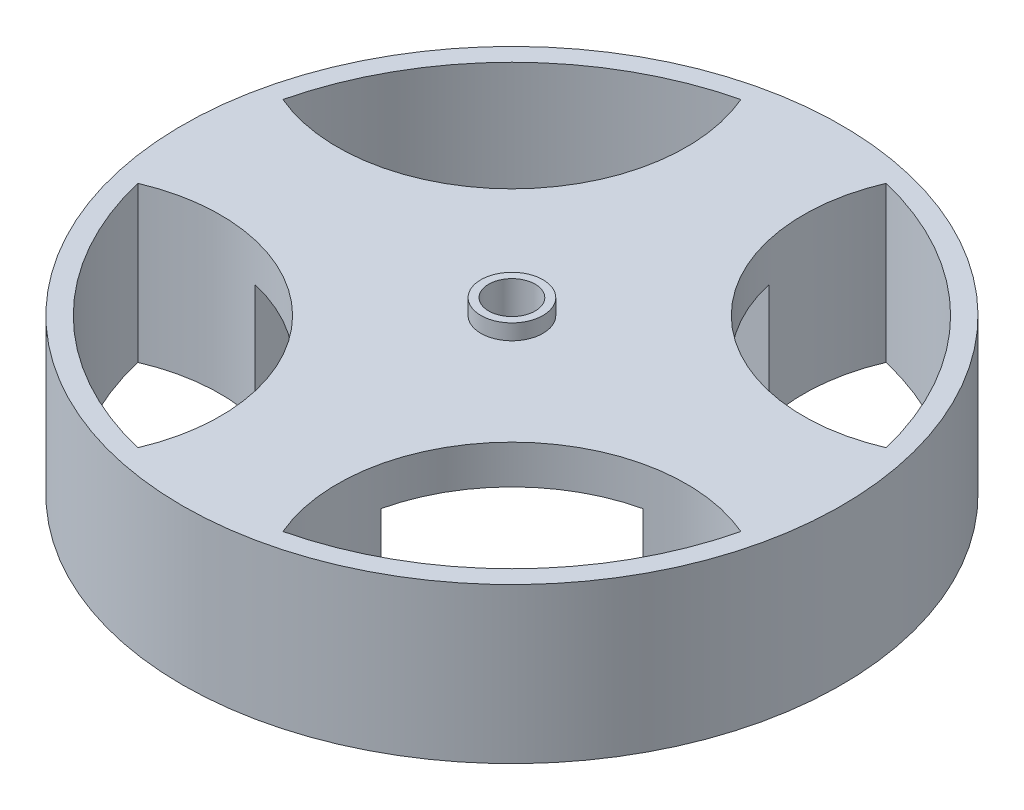
from build123d import *

# Parameters (mm, degrees)
SKETCH1_R           = 42.5
SKETCH1_R_2         = 40
BOSS_EXTRUDE1_DEPTH = 10
BOSS_EXTRUDE2_START = -5
BOSS_EXTRUDE2_DEPTH = 5
SKETCH3_R           = 4
SKETCH3_R_2         = 3
BOSS_EXTRUDE3_DEPTH = 2
SKETCH4_R           = 3
CUT_EXTRUDE1_DEPTH  = 64.344297297
BOSS_EXTRUDE4_START = 15
BOSS_EXTRUDE4_DEPTH = 15


with BuildPart() as part:
    # Sketch1 → Boss-Extrude1 (new, symmetric)
    with BuildSketch(Plane(origin=(0, 0, 0), x_dir=(1, 0, 0), z_dir=(0, 1, 0))):
        with Locations(Location((0, 0, 0), (0, 0, 270))):
            Circle(SKETCH1_R)
        with Locations(Location((0, 0, 0), (0, 0, 270))):
            Circle(SKETCH1_R_2, mode=Mode.SUBTRACT)
    extrude(amount=BOSS_EXTRUDE1_DEPTH, both=True)

    # Sketch2 → Boss-Extrude2 (add)
    with BuildSketch(Plane(origin=(0, 10, 0), x_dir=(1, 0, 0), z_dir=(0, 1, 0)).offset(BOSS_EXTRUDE2_START)):
        with BuildLine():
            ThreePointArc((-38.889408297, 9.36023089), (-14.142135624, 14.142135624), (-9.36023089, 38.889408297))
            ThreePointArc((-9.36023089, 38.889408297), (0, 40), (9.36023089, 38.889408297))
            ThreePointArc((9.36023089, 38.889408297), (14.142135624, 14.142135624), (38.889408297, 9.36023089))
            ThreePointArc((38.889408297, 9.36023089), (40, 0), (38.889408297, -9.36023089))
            ThreePointArc((38.889408297, -9.36023089), (14.142135624, -14.142135624), (9.36023089, -38.889408297))
            ThreePointArc((9.36023089, -38.889408297), (0, -40), (-9.36023089, -38.889408297))
            ThreePointArc((-9.36023089, -38.889408297), (-14.142135624, -14.142135624), (-38.889408297, -9.36023089))
            ThreePointArc((-38.889408297, -9.36023089), (-40, 0), (-38.889408297, 9.36023089))
        make_face()
    extrude(amount=BOSS_EXTRUDE2_DEPTH)

    # Sketch3 → Boss-Extrude3 (add)
    with BuildSketch(Plane(origin=(0, 10, 0), x_dir=(1, 0, 0), z_dir=(0, 1, 0))):
        with Locations(Location((0, 0, 0), (0, 0, 270))):
            Circle(SKETCH3_R)
        with Locations(Location((0, 0, 0), (0, 0, 270))):
            Circle(SKETCH3_R_2, mode=Mode.SUBTRACT)
    extrude(amount=BOSS_EXTRUDE3_DEPTH)

    # Sketch4 → Cut-Extrude1 (cut, through all)
    with BuildSketch(Plane(origin=(0, 10, 0), x_dir=(1, 0, 0), z_dir=(0, 1, 0))):
        with Locations(Location((0, 0, 0), (0, 0, 270))):
            Circle(SKETCH4_R)
    extrude(amount=-CUT_EXTRUDE1_DEPTH, mode=Mode.SUBTRACT)

    # Sketch5 → Boss-Extrude4 (add)
    with BuildSketch(Plane.XZ.offset(-5).offset(BOSS_EXTRUDE4_START)):
        with BuildLine():
            Line((-25, -8.126552801), (-25, 8.126552801))
            ThreePointArc((-25, 8.126552801), (-32.042685029, 7.64027064), (-38.889408297, 9.36023089))
            ThreePointArc((-38.889408297, 9.36023089), (-40, 0), (-38.889408297, -9.36023089))
            ThreePointArc((-38.889408297, -9.36023089), (-32.042685029, -7.64027064), (-25, -8.126552801))
        make_face()
        with BuildLine():
            Line((-8.126552801, 25), (8.126552801, 25))
            ThreePointArc((8.126552801, 25), (7.64027064, 32.042685029), (9.36023089, 38.889408297))
            ThreePointArc((9.36023089, 38.889408297), (0, 40), (-9.36023089, 38.889408297))
            ThreePointArc((-9.36023089, 38.889408297), (-7.64027064, 32.042685029), (-8.126552801, 25))
        make_face()
        with BuildLine():
            Line((25, 8.126552801), (25, -8.126552801))
            ThreePointArc((25, -8.126552801), (32.042685029, -7.64027064), (38.889408297, -9.36023089))
            ThreePointArc((38.889408297, -9.36023089), (40, 0), (38.889408297, 9.36023089))
            ThreePointArc((38.889408297, 9.36023089), (32.042685029, 7.64027064), (25, 8.126552801))
        make_face()
        with BuildLine():
            Line((8.126552801, -25), (-8.126552801, -25))
            ThreePointArc((-8.126552801, -25), (-7.64027064, -32.042685029), (-9.36023089, -38.889408297))
            ThreePointArc((-9.36023089, -38.889408297), (0, -40), (9.36023089, -38.889408297))
            ThreePointArc((9.36023089, -38.889408297), (7.64027064, -32.042685029), (8.126552801, -25))
        make_face()
    extrude(amount=-BOSS_EXTRUDE4_DEPTH)


solid = part.part
